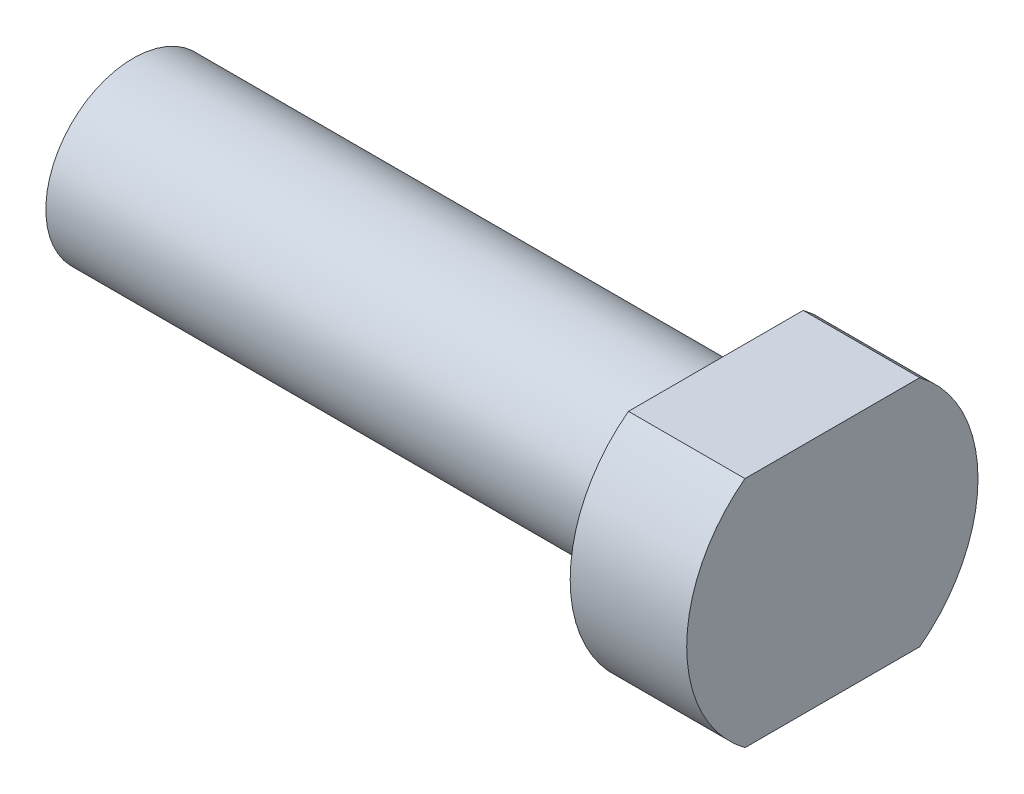
from build123d import *

# Parameters (mm, degrees)
SKETCH2_W          = 2
SKETCH2_H          = 5
CUT_EXTRUDE1_DEPTH = 1
SKETCH4_W          = 2
SKETCH4_H          = 3
CUT_EXTRUDE2_DEPTH = 1


with BuildPart() as part:
    # Sketch1 → Revolve1 (revolve)
    with BuildSketch(Plane.XY, mode=Mode.PRIVATE) as revolve1_sk:
        Polygon((0, 0), (0, -1.5), (10, -1.5), (10, -2.5), (12, -2.5), (12, 0), align=None)
    revolve(revolve1_sk.sketch.rotate(Axis((12, 0, 0), (-1, 0, 0)), 270), axis=Axis((12, 0, 0), (-1, 0, 0)))

    # Sketch2 → Cut-Extrude1 (cut)
    with BuildSketch(Plane(origin=(0, 3, 0), x_dir=(1, 0, 0), z_dir=(0, 1, 0))):
        with Locations((11, 0)):
            Rectangle(SKETCH2_W, SKETCH2_H)
    extrude(amount=-CUT_EXTRUDE1_DEPTH, mode=Mode.SUBTRACT)

    # Sketch4 → Cut-Extrude2 (cut)
    with BuildSketch(Plane(origin=(0, -3, 0), x_dir=(1, 0, 0), z_dir=(0, 1, 0))):
        with Locations((11, 0)):
            Rectangle(SKETCH4_W, SKETCH4_H)
    extrude(amount=CUT_EXTRUDE2_DEPTH, mode=Mode.SUBTRACT)


solid = part.part
